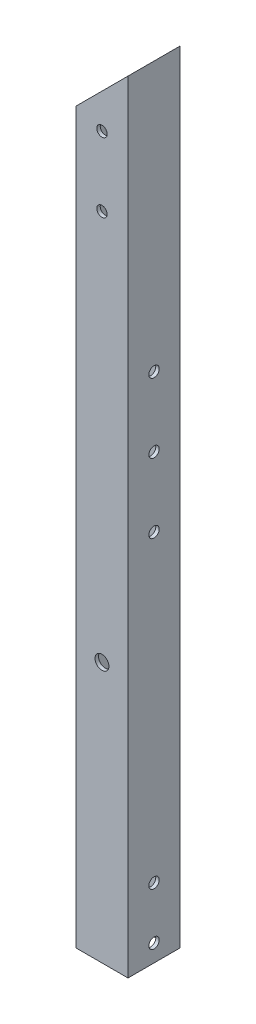
from build123d import *

# Parameters (mm, degrees)
SKETCH_1_W          = 15
SKETCH_1_H          = 15
SKETCH_1_W_2        = 13
SKETCH_1_H_2        = 13
EXTRUDE_1_DEPTH     = 225
SKETCH_2_R          = 1.5
SKETCH_2_R_2        = 2
CUT_EXTRUDE_1_DEPTH = 226.624134347
SKETCH_3_R          = 1.5
CUT_EXTRUDE_2_DEPTH = 226.624134347


with BuildPart() as part:
    # 草图1 → 凸台-拉伸1 (new body)
    with BuildSketch(Plane(origin=(0, 0, 0), x_dir=(1, 0, 0), z_dir=(0, 1, 0))):
        Rectangle(SKETCH_1_W, SKETCH_1_H)
        Rectangle(SKETCH_1_W_2, SKETCH_1_H_2, mode=Mode.SUBTRACT)
    extrude(amount=EXTRUDE_1_DEPTH)

    # 草图2 → 切除-拉伸1 (cut, through all)
    with BuildSketch(Plane.XY.offset(7.5)):
        with Locations((0, 207.5)):
            Circle(SKETCH_2_R)
        with Locations((0, 187.5)):
            Circle(SKETCH_2_R)
        with Locations((0, 75)):
            Circle(SKETCH_2_R_2)
        Polygon((7.5, 225), (-7.5, 225), (-7.5, 210), align=None)
    extrude(amount=-CUT_EXTRUDE_1_DEPTH, mode=Mode.SUBTRACT)

    # 草图3 → 切除-拉伸2 (cut, through all)
    with BuildSketch(Plane(origin=(7.5, 0, 0), x_dir=(0, 0, -1), z_dir=(1, 0, 0))):
        with Locations((0, 5)):
            Circle(SKETCH_3_R)
        with Locations((0, 20)):
            Circle(SKETCH_3_R)
        with Locations((0, 127.5)):
            Circle(SKETCH_3_R)
        with Locations((0, 147.5)):
            Circle(SKETCH_3_R)
        with Locations((0, 107.5)):
            Circle(SKETCH_3_R)
    extrude(amount=-CUT_EXTRUDE_2_DEPTH, mode=Mode.SUBTRACT)


solid = part.part
